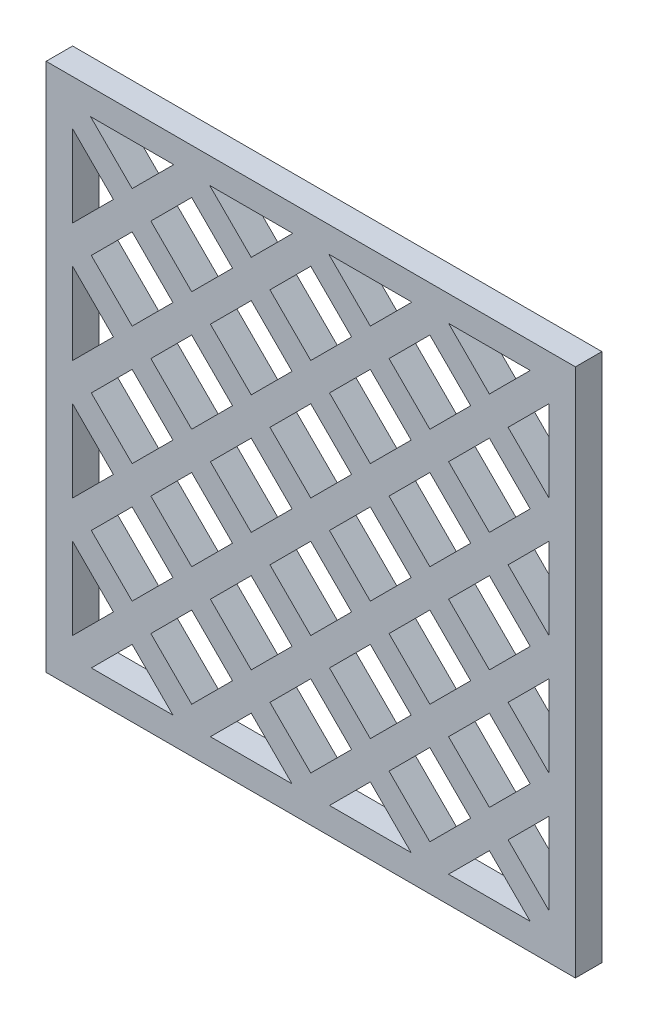
from build123d import *

# Parameters (mm, degrees)
SKETCH5_W           = 40
SKETCH5_H           = 40
BOSS_EXTRUDE2_DEPTH = 2
CUT_EXTRUDE1_DEPTH  = 2
CUT_EXTRUDE4_DEPTH  = 2
CUT_EXTRUDE5_DEPTH  = 2
CUT_EXTRUDE6_DEPTH  = 2
CUT_EXTRUDE7_DEPTH  = 2
CUT_EXTRUDE8_DEPTH  = 2


with BuildPart() as part:
    # Sketch5 → Boss-Extrude2 (new body)
    with BuildSketch(Plane.XY):
        Rectangle(SKETCH5_W, SKETCH5_H)
    extrude(amount=BOSS_EXTRUDE2_DEPTH)

    # Sketch4 → Cut-Extrude1 (cut)
    with BuildSketch(Plane.XY):
        Polygon((16.585786438, 18.056847711), (10.414213562, 18.056847711), (13.5, 14.971061274), align=None)
        Polygon((18, 10.414213562), (18, 16.585786438), (14.914213562, 13.5), align=None)
    extrude(amount=CUT_EXTRUDE1_DEPTH, mode=Mode.SUBTRACT)

    # Sketch4<5> → Cut-Extrude4 (cut)
    with BuildSketch(Plane.XY):
        Polygon((-13.5, -14.914213562), (-16.585786438, -18), (-10.414213562, -18), align=None)
        Polygon((-13.5, -12.085786438), (-10.414213562, -9), (-13.5, -5.914213562), (-16.585786438, -9), align=None)
        Polygon((-5.914213562, -13.5), (-9, -10.414213562), (-12.085786438, -13.5), (-9, -16.585786438), align=None)
        Polygon((-18, -16.585786438), (-14.914213562, -13.5), (-18, -10.414213562), align=None)
    extrude(amount=CUT_EXTRUDE4_DEPTH, mode=Mode.SUBTRACT)

    # Sketch4<6> → Cut-Extrude5 (cut)
    with BuildSketch(Plane.XY):
        Polygon((13.5, -14.914213562), (10.414213562, -18), (16.585786438, -18), align=None)
        Polygon((3.085786438, -13.5), (0, -10.414213562), (-3.085786438, -13.5), (0, -16.585786438), align=None)
        Polygon((-1.414213562, -18), (-4.5, -14.914213562), (-7.585786438, -18), align=None)
        Polygon((4.5, -5.914213562), (1.414213562, -9), (4.5, -12.085786438), (7.585786438, -9), align=None)
        Polygon((12.085786438, -13.5), (9, -10.414213562), (5.914213562, -13.5), (9, -16.585786438), align=None)
        Polygon((7.585786438, -18), (4.5, -14.914213562), (1.414213562, -18), align=None)
        Polygon((13.5, -5.914213562), (10.414213562, -9), (13.5, -12.085786438), (16.585786438, -9), align=None)
        Polygon((18, -16.585786438), (18, -10.414213562), (14.914213562, -13.5), align=None)
        Polygon((12.085786438, -4.5), (9, -1.414213562), (5.914213562, -4.5), (9, -7.585786438), align=None)
        Polygon((18, -7.585786438), (18, -1.414213562), (14.914213562, -4.5), align=None)
    extrude(amount=CUT_EXTRUDE5_DEPTH, mode=Mode.SUBTRACT)

    # Sketch4<7> → Cut-Extrude6 (cut)
    with BuildSketch(Plane.XY):
        Polygon((-4.5, -5.914213562), (-7.585786438, -9), (-4.5, -12.085786438), (-1.414213562, -9), align=None)
        Polygon((3.085786438, -4.5), (0, -1.414213562), (-3.085786438, -4.5), (0, -7.585786438), align=None)
        Polygon((4.5, 3.085786438), (1.414213562, 0), (4.5, -3.085786438), (7.585786438, 0), align=None)
        Polygon((13.5, 3.085786438), (10.414213562, 0), (13.5, -3.085786438), (16.585786438, 0), align=None)
        Polygon((3.085786438, 4.5), (0, 7.585786438), (-3.085786438, 4.5), (0, 1.414213562), align=None)
        Polygon((4.5, 12.085786438), (1.414213562, 9), (4.5, 5.914213562), (7.585786438, 9), align=None)
        Polygon((12.085786438, 4.5), (9, 7.585786438), (5.914213562, 4.5), (9, 1.414213562), align=None)
        Polygon((13.5, 12.085786438), (10.414213562, 9), (13.5, 5.914213562), (16.585786438, 9), align=None)
        Polygon((18, 1.414213562), (18, 7.585786438), (14.914213562, 4.5), align=None)
        Polygon((3.085786438, 13.5), (0, 16.585786438), (-3.085786438, 13.5), (0, 10.414213562), align=None)
        Polygon((7.642634149, 18.056847711), (1.357365851, 18.056847711), (4.5, 14.914213562), align=None)
        Polygon((12.085786438, 13.5), (9, 16.585786438), (5.914213562, 13.5), (9, 10.414213562), align=None)
    extrude(amount=CUT_EXTRUDE6_DEPTH, mode=Mode.SUBTRACT)

    # Sketch4<9> → Cut-Extrude7 (cut)
    with BuildSketch(Plane.XY):
        Polygon((-9, -7.585786438), (-5.914213562, -4.5), (-9, -1.414213562), (-12.085786438, -4.5), align=None)
        Polygon((-4.5, 3.085786438), (-7.585786438, 0), (-4.5, -3.085786438), (-1.414213562, 0), align=None)
        Polygon((-9, 1.414213562), (-5.914213562, 4.5), (-9, 7.585786438), (-12.085786438, 4.5), align=None)
        Polygon((-18, -7.585786438), (-14.914213562, -4.5), (-18, -1.414213562), align=None)
        Polygon((-13.5, 3.085786438), (-16.585786438, 0), (-13.5, -3.085786438), (-10.414213562, 0), align=None)
        Polygon((-18, 1.414213562), (-14.914213562, 4.5), (-18, 7.585786438), align=None)
    extrude(amount=CUT_EXTRUDE7_DEPTH, mode=Mode.SUBTRACT)

    # Sketch4<10> → Cut-Extrude8 (cut)
    with BuildSketch(Plane.XY):
        Polygon((-10.357365851, 18.056847711), (-16.642634149, 18.056847711), (-13.5, 14.914213562), align=None)
        Polygon((-14.914213562, 13.5), (-18, 16.585786438), (-18, 10.414213562), align=None)
        Polygon((-4.5, 12.085786438), (-7.585786438, 9), (-4.5, 5.914213562), (-1.414213562, 9), align=None)
        Polygon((-9, 10.414213562), (-5.914213562, 13.5), (-9, 16.585786438), (-12.085786438, 13.5), align=None)
        Polygon((-1.357365851, 18.056847711), (-7.642634149, 18.056847711), (-4.5, 14.914213562), align=None)
        Polygon((-13.5, 12.085786438), (-16.585786438, 9), (-13.5, 5.914213562), (-10.414213562, 9), align=None)
    extrude(amount=CUT_EXTRUDE8_DEPTH, mode=Mode.SUBTRACT)


solid = part.part
